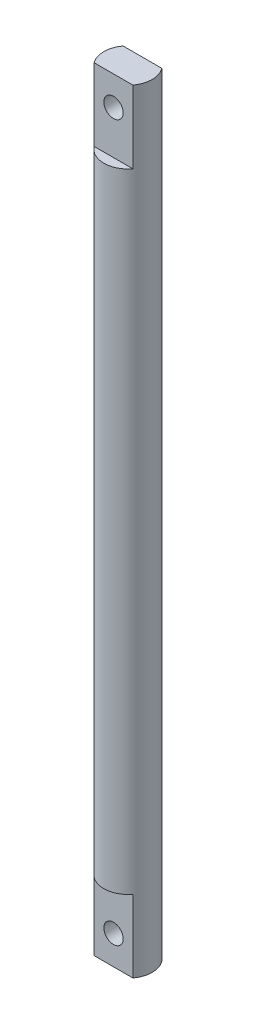
from build123d import *

# Parameters (mm, degrees)
SKETCH1_R           = 5
BOSS_EXTRUDE1_DEPTH = 80
CUT_EXTRUDE1_DEPTH  = 15
SKETCH3_R           = 2
CUT_EXTRUDE2_DEPTH  = 81.554329493


with BuildPart() as part:
    # Sketch1 → Boss-Extrude1 (new, symmetric)
    with BuildSketch(Plane(origin=(0, 0, 0), x_dir=(1, 0, 0), z_dir=(0, 1, 0))):
        with Locations(Location((0, 0, 0), (0, 0, 270))):
            Circle(SKETCH1_R)
    extrude(amount=BOSS_EXTRUDE1_DEPTH, both=True)

    # Sketch2 → Cut-Extrude1 (cut)
    with BuildSketch(Plane(origin=(0, 80, 0), x_dir=(1, 0, 0), z_dir=(0, 1, 0))):
        with BuildLine():
            Line((-4, -3), (4, -3))
            ThreePointArc((4, -3), (0, -5), (-4, -3))
        make_face()
        with BuildLine():
            Line((-4, 3), (4, 3))
            ThreePointArc((4, 3), (0, 5), (-4, 3))
        make_face()
    cut_extrude1 = extrude(amount=-CUT_EXTRUDE1_DEPTH, mode=Mode.SUBTRACT)

    # Mirror2: Cut-Extrude1 across plane
    add(cut_extrude1.mirror(Plane.ZX), mode=Mode.SUBTRACT)

    # Sketch3 → Cut-Extrude2 (cut, through all)
    with BuildSketch(Plane.XY.offset(3)):
        with Locations((0, 74)):
            Circle(SKETCH3_R)
    cut_extrude2 = extrude(amount=-CUT_EXTRUDE2_DEPTH, mode=Mode.SUBTRACT)

    # Mirror3: Cut-Extrude2 across plane
    add(cut_extrude2.mirror(Plane.ZX), mode=Mode.SUBTRACT)


solid = part.part
